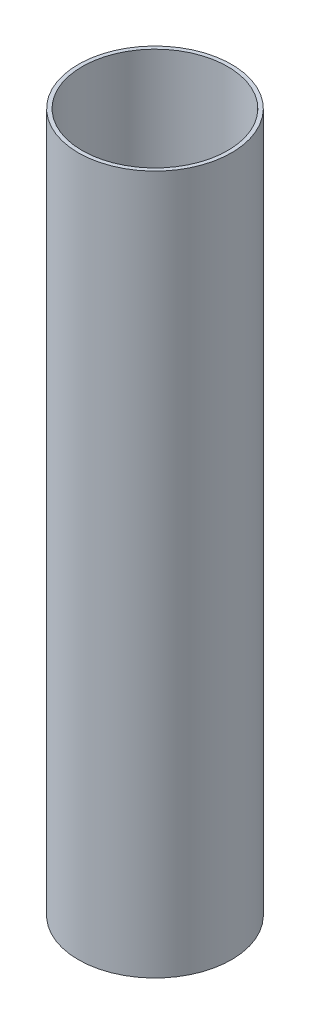
from build123d import *

# Parameters (mm, degrees)
SKETCH1_R           = 32.9
SKETCH1_R_2         = 31.25
BOSS_EXTRUDE1_DEPTH = 300


with BuildPart() as part:
    # Sketch1 → Boss-Extrude1 (new body)
    with BuildSketch(Plane(origin=(0, 0, 0), x_dir=(1, 0, 0), z_dir=(0, 1, 0))):
        with Locations(Location((0, 0, 0), (0, 0, 270))):
            Circle(SKETCH1_R)
        with Locations(Location((0, 0, 0), (0, 0, 270))):
            Circle(SKETCH1_R_2, mode=Mode.SUBTRACT)
    extrude(amount=BOSS_EXTRUDE1_DEPTH)


solid = part.part
